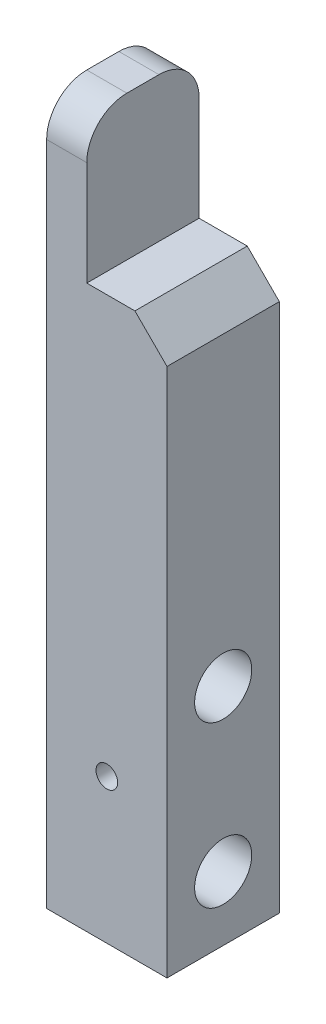
from build123d import *

# Parameters (mm, degrees)
EXTRUDE_1_DEPTH     = 7
SKETCH_3_R          = 3.56
CUT_EXTRUDE_1_DEPTH = 20
SKETCH_4_R          = 1.35
CUT_EXTRUDE_2_DEPTH = 14
FILLET_1_R          = 5
CHAMFER_1_SIZE      = 4


with BuildPart() as part:
    # 草图1 → 凸台-拉伸1 (new, symmetric)
    with BuildSketch(Plane.XY):
        Polygon((-7.5, -18), (7.5, -18), (7.5, 23), (7.5, 52), (-2.5, 52), (-2.5, 70), (-7.5, 70), (-7.5, 52), (-7.5, 47), align=None)
    extrude(amount=EXTRUDE_1_DEPTH, both=True)

    # 草图3 → 切除-拉伸1 (cut)
    with BuildSketch(Plane(origin=(7.5, 0, 0), x_dir=(0, 0, -1), z_dir=(1, 0, 0))):
        with Locations((0, -10)):
            Circle(SKETCH_3_R)
        with Locations((0, 10)):
            Circle(SKETCH_3_R)
    extrude(amount=-CUT_EXTRUDE_1_DEPTH, mode=Mode.SUBTRACT)

    # 草图4 → 切除-拉伸2 (cut)
    with BuildSketch(Plane.XY.offset(7)):
        Circle(SKETCH_4_R)
    extrude(amount=-CUT_EXTRUDE_2_DEPTH, mode=Mode.SUBTRACT)

    # 圆角1
    fillet_1_edges = [part.edges().sort_by_distance(p)[0] for p in [
        (-5, 70, 7),
        (-5, 70, -7),
    ]]
    fillet(fillet_1_edges, radius=FILLET_1_R)

    # 倒角1
    chamfer_1_edges = [part.edges().sort_by_distance(p)[0] for p in [
        (7.5, 52, 0),
    ]]
    chamfer(chamfer_1_edges, length=CHAMFER_1_SIZE)


solid = part.part
